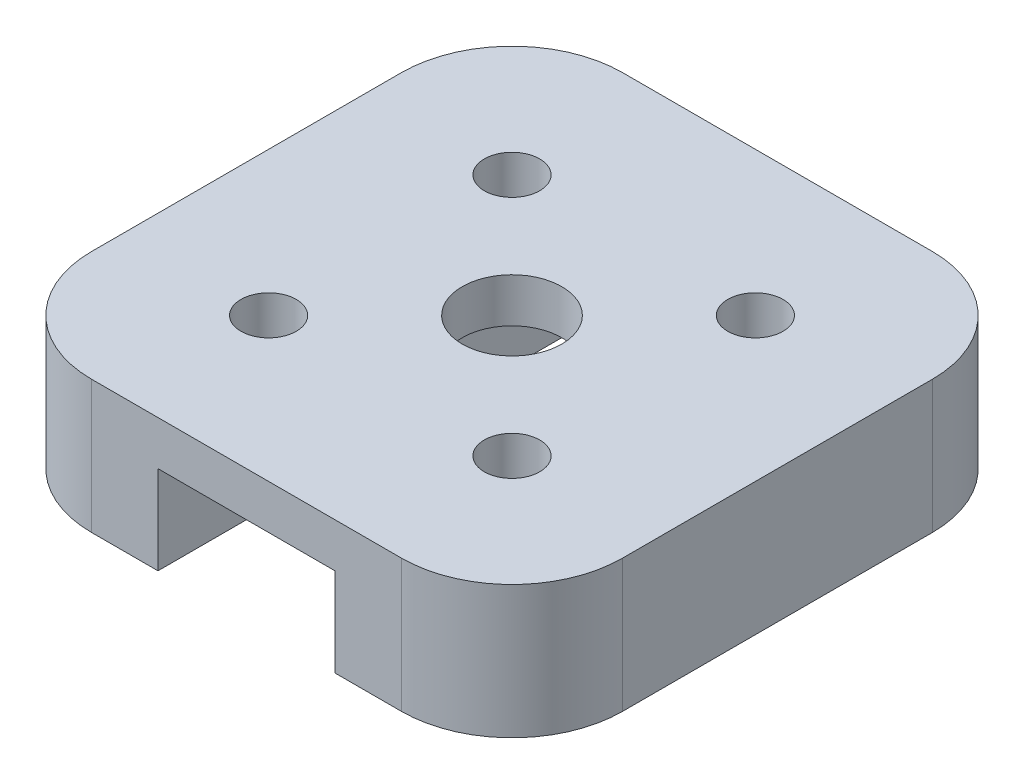
from build123d import *

# Parameters (mm, degrees)
SKETCH1_R               = 1.25
SKETCH1_R_2             = 2.25
BOSS_EXTRUDE1_DEPTH     = 6
CUT_EXTRUDE1_DEPTH      = 28.49545417
CUT_EXTRUDE1_DEPTH_BACK = 28.49545417
SKETCH2_W               = 8
SKETCH2_H               = 4


with BuildPart() as part:
    # Sketch1 → Boss-Extrude1 (new body)
    with BuildSketch(Plane(origin=(0, 0, 0), x_dir=(1, 0, 0), z_dir=(0, 1, 0))):
        with BuildLine():
            Line((-7, 12), (7, 12))
            ThreePointArc((7, 12), (10.535533906, 10.535533906), (12, 7))
            Line((12, 7), (12, -7))
            ThreePointArc((12, -7), (10.535533906, -10.535533906), (7, -12))
            Line((7, -12), (-7, -12))
            ThreePointArc((-7, -12), (-10.535533906, -10.535533906), (-12, -7))
            Line((-12, -7), (-12, 7))
            ThreePointArc((-12, 7), (-10.535533906, 10.535533906), (-7, 12))
        make_face()
        with Locations(Location((-5.5, 5.5, 0), (0, 0, 270))):
            Circle(SKETCH1_R, mode=Mode.SUBTRACT)
        with Locations(Location((5.5, 5.5, 0), (0, 0, 270))):
            Circle(SKETCH1_R, mode=Mode.SUBTRACT)
        with Locations(Location((5.5, -5.5, 0), (0, 0, 270))):
            Circle(SKETCH1_R, mode=Mode.SUBTRACT)
        with Locations(Location((-5.5, -5.5, 0), (0, 0, 270))):
            Circle(SKETCH1_R, mode=Mode.SUBTRACT)
        with Locations(Location((0, 0, 0), (0, 0, 270))):
            Circle(SKETCH1_R_2, mode=Mode.SUBTRACT)
    extrude(amount=BOSS_EXTRUDE1_DEPTH)

    # Sketch2 → Cut-Extrude1 (cut, two sides: drawn at the far end of the back side and taken through both)
    with BuildSketch(Plane.XY.offset(12).offset(-CUT_EXTRUDE1_DEPTH_BACK)):
        with Locations((0, 2)):
            Rectangle(SKETCH2_W, SKETCH2_H)
    extrude(amount=CUT_EXTRUDE1_DEPTH + CUT_EXTRUDE1_DEPTH_BACK, mode=Mode.SUBTRACT)


solid = part.part
